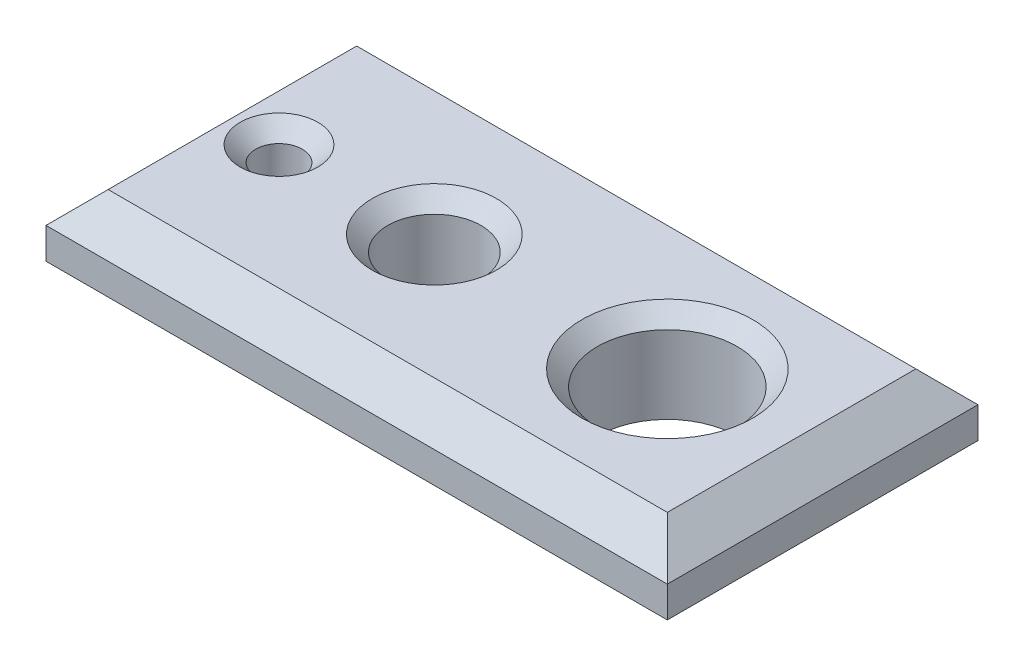
from build123d import *

# Parameters (mm, degrees)
SKETCH_1_W      = 200
SKETCH_1_H      = 100
EXTRUDE_1_DEPTH = 30
SKETCH_2_R      = 7.5
SKETCH_2_R_2    = 15
SKETCH_2_R_3    = 22.5
EXTRUDE_2_DEPTH = 30
CHAMFER_1_SIZE  = 5
CHAMFER_2_SIZE  = 10
CHAMFER_3_SIZE  = 10


with BuildPart() as part:
    # 草圖1 → 擠出1 (new body)
    with BuildSketch(Plane(origin=(0, 0, 0), x_dir=(-1, 0, 0), z_dir=(0, 1, 0))):
        with Locations((-100, -50)):
            Rectangle(SKETCH_1_W, SKETCH_1_H)
    extrude(amount=EXTRUDE_1_DEPTH)

    # 草圖2 → 擠出2 (cut)
    with BuildSketch(Plane(origin=(0, 30, 0), x_dir=(-1, 0, 0), z_dir=(0, 1, 0))):
        with Locations(Location((-25, -50, 0), (0, 0, 90))):
            Circle(SKETCH_2_R)
        with Locations(Location((-75, -50, 0), (0, 0, 90))):
            Circle(SKETCH_2_R_2)
        with Locations(Location((-150, -50, 0), (0, 0, 90))):
            Circle(SKETCH_2_R_3)
    extrude(amount=-EXTRUDE_2_DEPTH, mode=Mode.SUBTRACT)

    # 倒角1
    chamfer_1_edges = [part.edges().sort_by_distance(p)[0] for p in [
        (25, 30, -57.5),
        (75, 30, -65),
        (150, 30, -72.5),
    ]]
    chamfer(chamfer_1_edges, length=CHAMFER_1_SIZE)

    # 倒角2
    chamfer_2_edges = [part.edges().sort_by_distance(p)[0] for p in [
        (200, 30, -50),
        (100, 30, -100),
        (0, 30, -50),
        (100, 30, 0),
    ]]
    chamfer(chamfer_2_edges, length=CHAMFER_2_SIZE)

    # 倒角3
    chamfer_3_edges = [part.edges().sort_by_distance(p)[0] for p in [
        (100, 0, -100),
        (200, 0, -50),
        (100, 0, 0),
        (0, 0, -50),
    ]]
    chamfer(chamfer_3_edges, length=CHAMFER_3_SIZE)


solid = part.part
